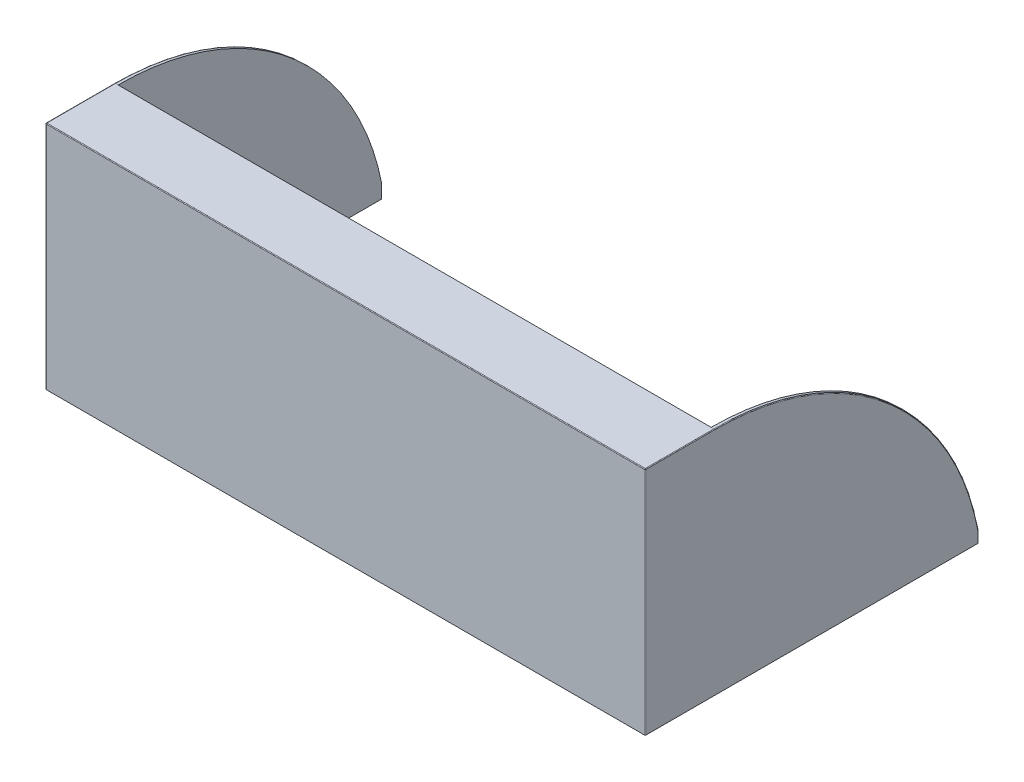
from build123d import *

# Parameters (mm, degrees)
SKETCH1_W           = 180
SKETCH1_H           = 20
BOSS_EXTRUDE2_DEPTH = 1
BOSS_EXTRUDE3_DEPTH = 1
BOSS_EXTRUDE5_START = 1
BOSS_EXTRUDE5_DEPTH = 1
SKETCH6_W           = 182
SKETCH6_H           = 70
BOSS_EXTRUDE6_DEPTH = 1
FILLET2_R           = 0.2


with BuildPart() as part:
    # Sketch1 → Boss-Extrude2 (new body)
    with BuildSketch(Plane(origin=(0, 0, 0), x_dir=(1, 0, 0), z_dir=(0, 1, 0))):
        with Locations((0, 10)):
            Rectangle(SKETCH1_W, SKETCH1_H)
    extrude(amount=BOSS_EXTRUDE2_DEPTH)

    # Sketch3 → Boss-Extrude3 (add)
    with BuildSketch(Plane(origin=(90, 0, 0), x_dir=(0, 0, -1), z_dir=(1, 0, 0))):
        with BuildLine():
            Line((0, 1), (0, -69))
            Line((0, -69), (100, -69))
            Line((100, -69), (100, -64.892848271))
            ThreePointArc((100, -64.892848271), (71.821490362, -17.594043661), (20, 1))
            Line((20, 1), (0, 1))
        make_face()
    extrude(amount=BOSS_EXTRUDE3_DEPTH)

    # Sketch5 → Boss-Extrude5 (add)
    with BuildSketch(Plane.ZY.offset(90).offset(BOSS_EXTRUDE5_START)):
        with BuildLine():
            Line((0, 1), (-20, 1))
            ThreePointArc((-20, 1), (-71.821490362, -17.594043661), (-100, -64.892848271))
            Line((-100, -64.892848271), (-100, -69))
            Line((-100, -69), (0, -69))
            Line((0, -69), (0, 1))
        make_face()
    extrude(amount=-BOSS_EXTRUDE5_DEPTH)

    # Sketch6 → Boss-Extrude6 (add)
    with BuildSketch(Plane.XY):
        with Locations((0, -34)):
            Rectangle(SKETCH6_W, SKETCH6_H)
    extrude(amount=BOSS_EXTRUDE6_DEPTH)

    # Fillet2
    fillet2_edges = [part.edges().sort_by_distance(p)[0] for p in [
        (91, 1, -9.5),
        (91, -17.594043661, -71.821490362),
        (-91, 1, -9.5),
        (-91, -17.594043661, -71.821490362),
        (-91, -34, 1),
        (91, -34, 1),
        (0, 1, 1),
    ]]
    fillet(fillet2_edges, radius=FILLET2_R)


solid = part.part
